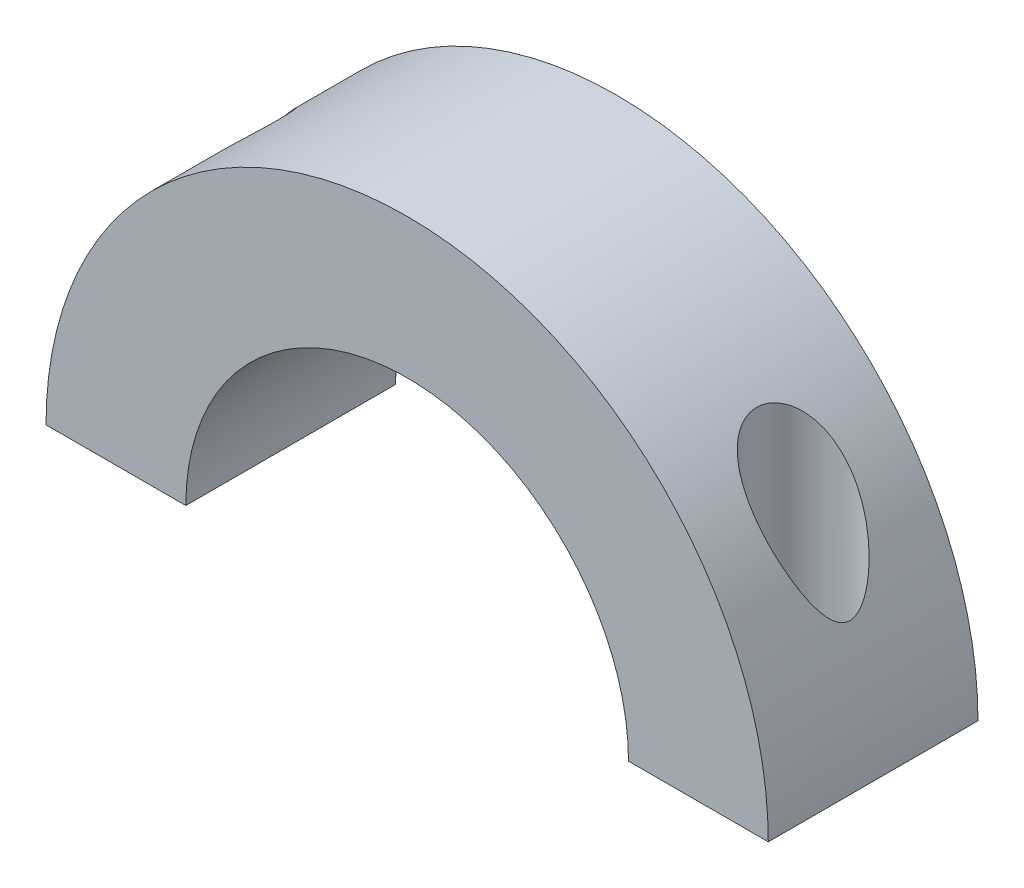
from build123d import *

# Parameters (mm, degrees)
BOSS_EXTRUDE1_DEPTH = 18
SKETCH2_R           = 2
CUT_EXTRUDE1_DEPTH  = 48.391982444
SKETCH3_R           = 4
CUT_EXTRUDE2_DEPTH  = 44.703546936


with BuildPart() as part:
    # Sketch1 → Boss-Extrude1 (new body)
    with BuildSketch(Plane.XY):
        with BuildLine():
            Line((-31, 0), (-19, 0))
            ThreePointArc((-19, 0), (0, 19), (19, 0))
            Line((19, 0), (31, 0))
            ThreePointArc((31, 0), (0, 31), (-31, 0))
        make_face()
    extrude(amount=BOSS_EXTRUDE1_DEPTH)

    # Sketch2 → Cut-Extrude1 (cut, through all)
    with BuildSketch(Plane.XZ):
        with Locations(Location((-24.165982166, 9, 0), (0, 0, 270))):
            Circle(SKETCH2_R)
        with Locations(Location((25, 9, 0), (0, 0, 270))):
            Circle(SKETCH2_R)
    extrude(amount=-CUT_EXTRUDE1_DEPTH, mode=Mode.SUBTRACT)

    # Sketch3 → Cut-Extrude2 (cut, through all)
    with BuildSketch(Plane(origin=(0, 6, 0), x_dir=(1, 0, 0), z_dir=(0, 1, 0))):
        with Locations(Location((-24.165982166, -9, 0), (0, 0, 90))):
            Circle(SKETCH3_R)
        with Locations(Location((25, -9, 0), (0, 0, 90))):
            Circle(SKETCH3_R)
    extrude(amount=CUT_EXTRUDE2_DEPTH, mode=Mode.SUBTRACT)


solid = part.part
